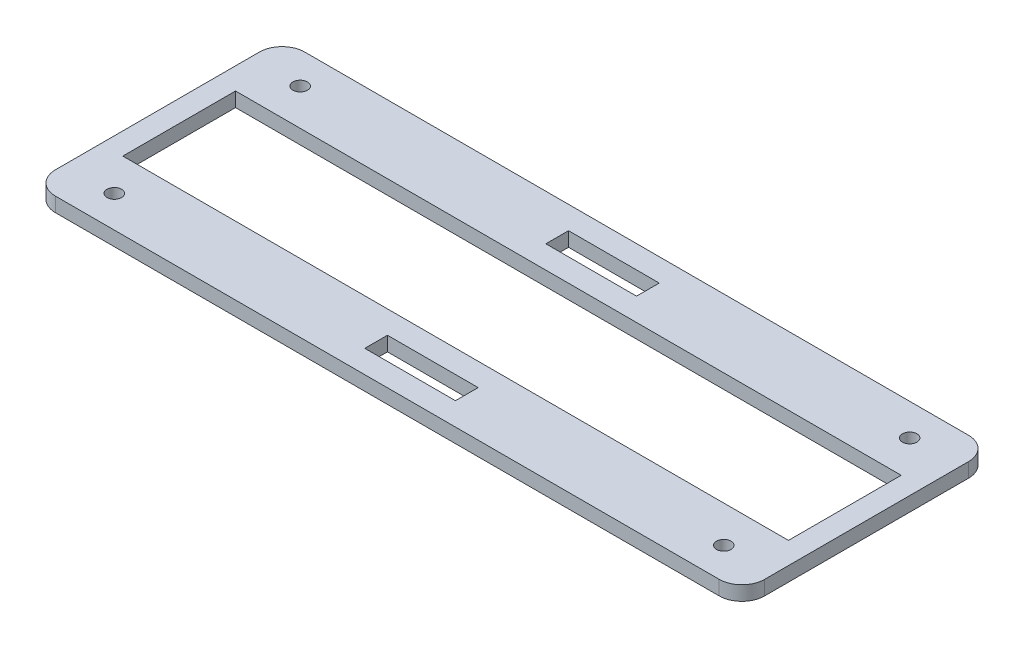
from build123d import *

# Parameters (mm, degrees)
SKETCH1_W           = 156.4
SKETCH1_H           = 55
BOSS_EXTRUDE1_DEPTH = 3.175
SKETCH2_R           = 1.6
CUT_EXTRUDE1_DEPTH  = 83.955232656
SKETCH5_W           = 146.78
SKETCH5_H           = 24.86
CUT_EXTRUDE4_DEPTH  = 3.175
SKETCH6_W           = 20
SKETCH6_H           = 5
CUT_EXTRUDE5_DEPTH  = 83.955232656
FILLET1_R           = 5


with BuildPart() as part:
    # Sketch1 → Boss-Extrude1 (new body)
    with BuildSketch(Plane(origin=(0, 0, 0), x_dir=(1, 0, 0), z_dir=(0, 1, 0))):
        Rectangle(SKETCH1_W, SKETCH1_H)
    extrude(amount=BOSS_EXTRUDE1_DEPTH)

    # Sketch2 → Cut-Extrude1 (cut, through all)
    with BuildSketch(Plane.XZ):
        with Locations(Location((67.2, 20.5, 0), (0, 0, 270))):
            Circle(SKETCH2_R)
        with Locations(Location((67.2, -20.5, 0), (0, 0, 270))):
            Circle(SKETCH2_R)
        with Locations(Location((-67.2, -20.5, 0), (0, 0, 270))):
            Circle(SKETCH2_R)
        with Locations(Location((-67.2, 20.5, 0), (0, 0, 270))):
            Circle(SKETCH2_R)
    extrude(amount=-CUT_EXTRUDE1_DEPTH, mode=Mode.SUBTRACT)

    # Sketch5 → Cut-Extrude4 (cut)
    with BuildSketch(Plane.XZ):
        Rectangle(SKETCH5_W, SKETCH5_H)
    extrude(amount=-CUT_EXTRUDE4_DEPTH, mode=Mode.SUBTRACT)

    # Sketch6 → Cut-Extrude5 (cut, through all)
    with BuildSketch(Plane(origin=(0, 0, 0), x_dir=(-1, 0, 0), z_dir=(0, -1, 0))):
        with Locations((0, -19.965)):
            Rectangle(SKETCH6_W, SKETCH6_H)
        with Locations((0, 19.965)):
            Rectangle(SKETCH6_W, SKETCH6_H)
    extrude(amount=-CUT_EXTRUDE5_DEPTH, mode=Mode.SUBTRACT)

    # Fillet1
    fillet1_edges = [part.edges().sort_by_distance(p)[0] for p in [
        (78.2, 1.5875, 27.5),
        (-78.2, 1.5875, 27.5),
        (-78.2, 1.5875, -27.5),
        (78.2, 1.5875, -27.5),
    ]]
    fillet(fillet1_edges, radius=FILLET1_R)


solid = part.part
